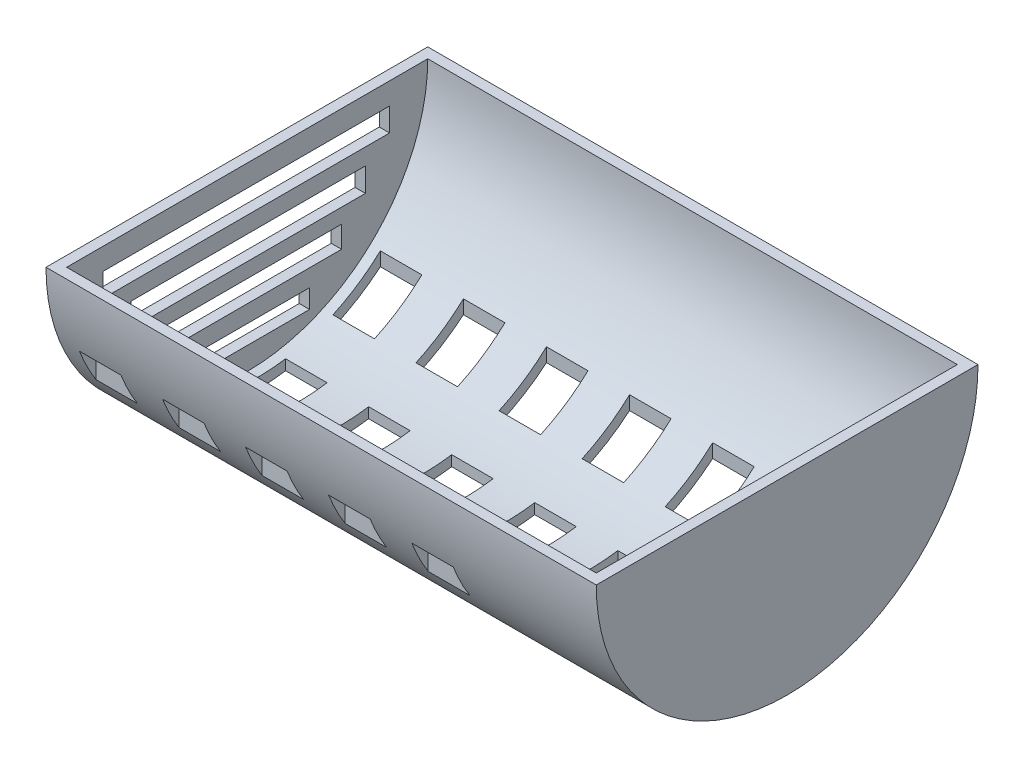
from build123d import *

# Parameters (mm, degrees)
REVOLVE_1_ANGLE     = 180
CUT_EXTRUDE_START   = -100
SKETCH_6_W          = 12.076682438
SKETCH_6_H          = 14.39053984
SKETCH_6_H_2        = 13.782632099
SKETCH_6_H_3        = 13.782632098
SKETCH_6_H_4        = 22.837839873
CUT_EXTRUDE_3_DEPTH = 80
SKETCH_7_W          = 83.279125937
SKETCH_7_H          = 6.800730915
SKETCH_7_W_2        = 68.126620215
SKETCH_7_H_2        = 6.920041983
SKETCH_7_W_3        = 56.91137976
SKETCH_7_H_3        = 6.32348664
SKETCH_7_W_4        = 38.179541977
SKETCH_7_H_4        = 5.488309159
CUT_EXTRUDE_4_DEPTH = 80


with BuildPart() as part:
    # 草图1 → 旋转1 (revolve)
    with BuildSketch(Plane(origin=(0, 0, 0), x_dir=(1, 0, 0), z_dir=(0, 1, 0))):
        Polygon((-78.924564797, 0), (-81.924564797, 0), (-81.924564797, -55.5), (78.075435203, -55.5), (78.075435203, 0), (75.075435203, 0), (75.075435203, -52.5), (-78.924564797, -52.5), align=None)
    revolve(axis=Axis((-95.756286267, 0, 0), (1, 0, 0)), revolution_arc=REVOLVE_1_ANGLE)

    # 草图6 → 切除-拉伸3 (cut)
    with BuildSketch(Plane(origin=(0, 0, 0), x_dir=(1, 0, 0), z_dir=(0, 1, 0)).offset(CUT_EXTRUDE_START)):
        with Locations((-69.886223578, 56.69526992)):
            Rectangle(SKETCH_6_W, SKETCH_6_H)
        with Locations((-69.886223578, 28.826051853)):
            Rectangle(SKETCH_6_W, SKETCH_6_H_2)
        with Locations((-69.886223578, 1.260787656)):
            Rectangle(SKETCH_6_W, SKETCH_6_H_3)
        with Locations((-69.886223578, -26.304476541)):
            Rectangle(SKETCH_6_W, SKETCH_6_H_2)
        with Locations((-69.886223578, -58.397344625)):
            Rectangle(SKETCH_6_W, SKETCH_6_H_4)
        with Locations((-45.732858702, 56.69526992)):
            Rectangle(SKETCH_6_W, SKETCH_6_H)
        with Locations((-21.579493826, 56.69526992)):
            Rectangle(SKETCH_6_W, SKETCH_6_H)
        with Locations((2.57387105, 56.69526992)):
            Rectangle(SKETCH_6_W, SKETCH_6_H)
        with Locations((26.727235926, 56.69526992)):
            Rectangle(SKETCH_6_W, SKETCH_6_H)
        with Locations((-45.732858702, -58.397344625)):
            Rectangle(SKETCH_6_W, SKETCH_6_H_4)
        with Locations((-21.579493826, -58.397344625)):
            Rectangle(SKETCH_6_W, SKETCH_6_H_4)
        with Locations((2.57387105, -58.397344625)):
            Rectangle(SKETCH_6_W, SKETCH_6_H_4)
        with Locations((26.727235926, -58.397344625)):
            Rectangle(SKETCH_6_W, SKETCH_6_H_4)
        with Locations((-45.732858702, 28.826051853)):
            Rectangle(SKETCH_6_W, SKETCH_6_H_2)
        with Locations((-21.579493826, 28.826051853)):
            Rectangle(SKETCH_6_W, SKETCH_6_H_2)
        with Locations((2.57387105, 28.826051853)):
            Rectangle(SKETCH_6_W, SKETCH_6_H_2)
        with Locations((26.727235926, 28.826051853)):
            Rectangle(SKETCH_6_W, SKETCH_6_H_2)
        with Locations((-45.732858702, 1.260787656)):
            Rectangle(SKETCH_6_W, SKETCH_6_H_3)
        with Locations((-21.579493826, 1.260787656)):
            Rectangle(SKETCH_6_W, SKETCH_6_H_3)
        with Locations((2.57387105, 1.260787656)):
            Rectangle(SKETCH_6_W, SKETCH_6_H_3)
        with Locations((26.727235926, 1.260787656)):
            Rectangle(SKETCH_6_W, SKETCH_6_H_3)
        with Locations((26.727235926, -26.304476541)):
            Rectangle(SKETCH_6_W, SKETCH_6_H_2)
        with Locations((2.57387105, -26.304476541)):
            Rectangle(SKETCH_6_W, SKETCH_6_H_2)
        with Locations((-21.579493826, -26.304476541)):
            Rectangle(SKETCH_6_W, SKETCH_6_H_2)
        with Locations((-45.732858702, -26.304476541)):
            Rectangle(SKETCH_6_W, SKETCH_6_H_2)
    extrude(amount=CUT_EXTRUDE_3_DEPTH, mode=Mode.SUBTRACT)

    # 草图7 → 切除-拉伸4 (cut)
    with BuildSketch(Plane.ZY.offset(81.924564797)):
        with Locations((0.238622138, -9.73402863)):
            Rectangle(SKETCH_7_W, SKETCH_7_H)
        with Locations((-0.298277671, -21.366857825)):
            Rectangle(SKETCH_7_W_2, SKETCH_7_H_2)
        with Locations((1.014144084, -32.28382061)):
            Rectangle(SKETCH_7_W_3, SKETCH_7_H_3)
        with Locations((0.95448855, -43.200783394)):
            Rectangle(SKETCH_7_W_4, SKETCH_7_H_4)
    extrude(amount=-CUT_EXTRUDE_4_DEPTH, mode=Mode.SUBTRACT)


solid = part.part
